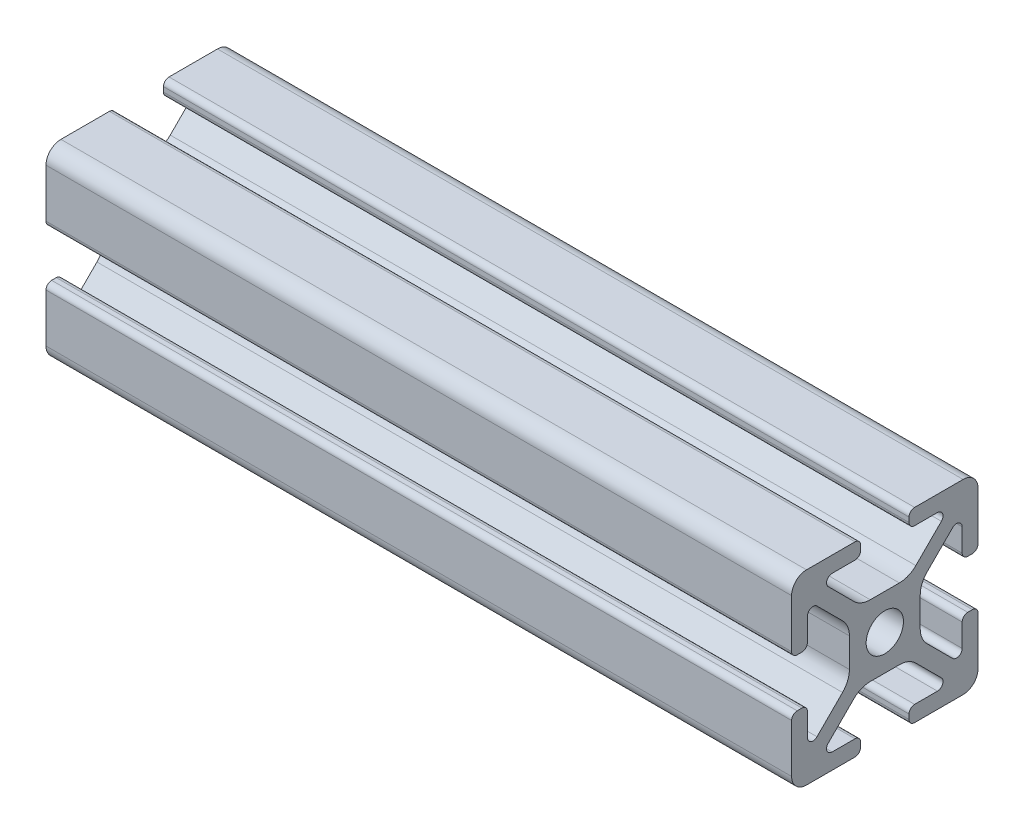
from build123d import *

# Parameters (mm, degrees)
BOSS_EXTRUDE1_DEPTH      = 50.8
BOSS_EXTRUDE1_DEPTH_BACK = 50.8


with BuildPart() as part:
    # Sketch3 → Boss-Extrude1 (new, two sides: drawn at the far end of the back side and taken through both)
    with BuildSketch(Plane(origin=(0, 0, 0), x_dir=(0, 0, -1), z_dir=(1, 0, 0)).offset(-BOSS_EXTRUDE1_DEPTH_BACK)):
        with BuildLine():
            Line((0, 4.826), (1.984228399, 4.826))
            ThreePointArc((1.984228399, 4.826), (3.199248297, 5.067682484), (4.229292429, 5.75593597))
            Line((4.229292429, 5.75593597), (7.713541092, 9.240184633))
            ThreePointArc((7.713541092, 9.240184633), (7.878721929, 10.070604775), (7.174725725, 10.541))
            Line((7.174725725, 10.541), (4.064, 10.541))
            ThreePointArc((4.064, 10.541), (3.525184633, 10.764184633), (3.302, 11.303))
            Line((3.302, 11.303), (3.302, 11.938))
            ThreePointArc((3.302, 11.938), (3.525184633, 12.476815367), (4.064, 12.7))
            Line((4.064, 12.7), (10.668, 12.7))
            ThreePointArc((10.668, 12.7), (12.104840979, 12.104840979), (12.7, 10.668))
            Line((12.7, 10.668), (12.7, 4.064))
            ThreePointArc((12.7, 4.064), (12.476815367, 3.525184633), (11.938, 3.302))
            Line((11.938, 3.302), (11.303, 3.302))
            ThreePointArc((11.303, 3.302), (10.764184633, 3.525184633), (10.541, 4.064))
            Line((10.541, 4.064), (10.541, 7.174725725))
            ThreePointArc((10.541, 7.174725725), (10.070604775, 7.878721929), (9.240184633, 7.713541092))
            Line((9.240184633, 7.713541092), (5.75593597, 4.229292429))
            ThreePointArc((5.75593597, 4.229292429), (5.067682484, 3.199248297), (4.826, 1.984228399))
            Line((4.826, 1.984228399), (4.826, 0))
            Line((4.826, 0), (2.54, 0))
            ThreePointArc((2.54, 0), (1.796051224, 1.796051224), (0, 2.54))
            Line((0, 2.54), (0, 4.826))
        make_face()
    extrude(amount=BOSS_EXTRUDE1_DEPTH + BOSS_EXTRUDE1_DEPTH_BACK)

    # Mirror1: part across plane


with BuildPart() as part_1:
    add(part.part)
    add(part.part.mirror(Plane.ZX))

    # Mirror2: part across plane


with BuildPart() as part_2:
    add(part_1.part)
    add(part_1.part.mirror(Plane.XY))


solid = part_2.part
